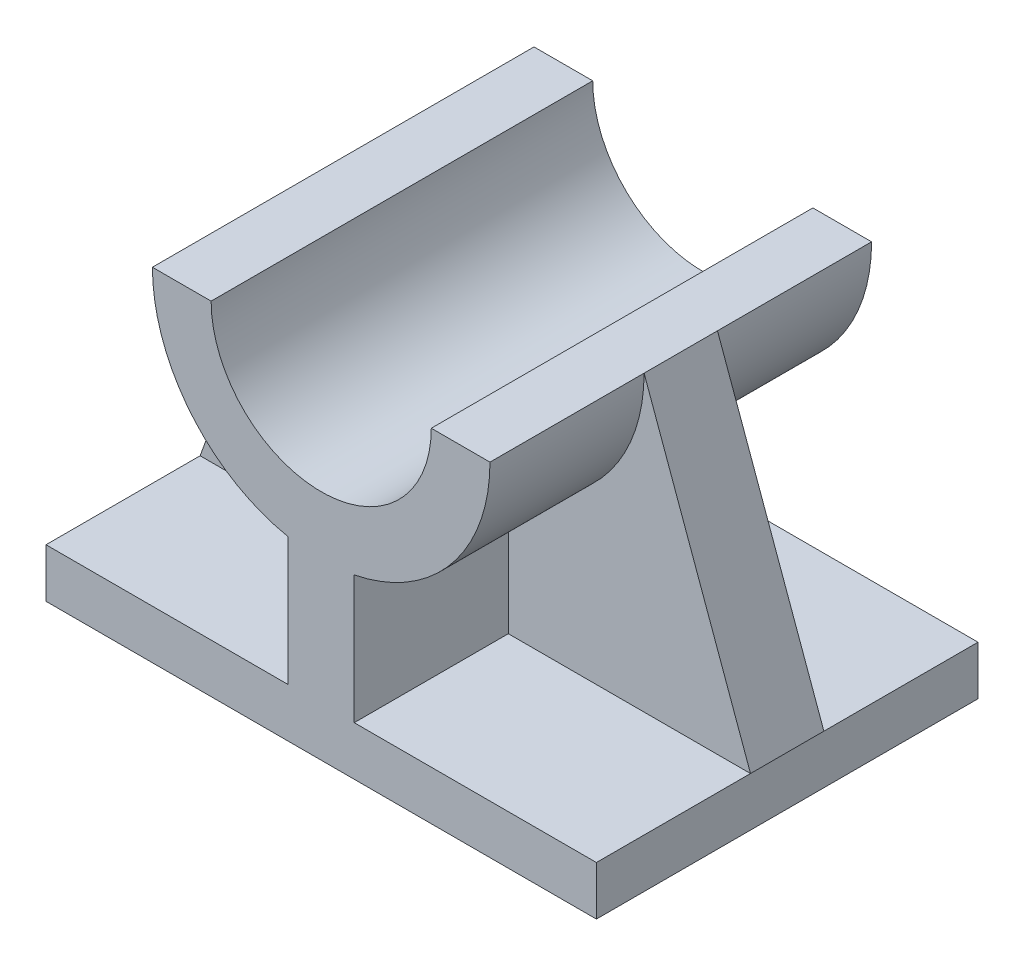
from build123d import *

# Parameters (mm, degrees)
BOSS_EXTRUDE1_DEPTH = 26
BOSS_EXTRUDE2_DEPTH = 5


with BuildPart() as part:
    # Sketch1 → Boss-Extrude1 (new, symmetric)
    with BuildSketch(Plane.XY):
        with BuildLine():
            Line((75, 6.678571429), (42, 6.678571429))
            Line((42, 6.678571429), (42, 24.123084291))
            ThreePointArc((42, 24.123084291), (55.283419244, 32.092619283), (60.5, 46.678571429))
            Line((60.5, 46.678571429), (52.5, 46.678571429))
            ThreePointArc((52.5, 46.678571429), (37.5, 31.678571429), (22.5, 46.678571429))
            Line((22.5, 46.678571429), (14.5, 46.678571429))
            ThreePointArc((14.5, 46.678571429), (19.716580756, 32.092619283), (33, 24.123084291))
            Line((33, 24.123084291), (33, 6.678571429))
            Line((33, 6.678571429), (0, 6.678571429))
            Line((0, 6.678571429), (0, 0))
            Line((0, 0), (75, 0))
            Line((75, 0), (75, 6.678571429))
        make_face()
    extrude(amount=BOSS_EXTRUDE1_DEPTH, both=True)

    # Sketch1<3> → Boss-Extrude2 (add, symmetric)
    with BuildSketch(Plane.XY):
        with BuildLine():
            Line((42, 24.123084291), (42, 6.678571429))
            Line((42, 6.678571429), (75, 6.678571429))
            Line((75, 6.678571429), (60.5, 46.678571429))
            ThreePointArc((60.5, 46.678571429), (55.283419244, 32.092619283), (42, 24.123084291))
        make_face()
        with BuildLine():
            Line((14.5, 46.678571429), (0, 6.678571429))
            Line((0, 6.678571429), (33, 6.678571429))
            Line((33, 6.678571429), (33, 24.123084291))
            ThreePointArc((33, 24.123084291), (19.716580756, 32.092619283), (14.5, 46.678571429))
        make_face()
    extrude(amount=BOSS_EXTRUDE2_DEPTH, both=True)


solid = part.part
